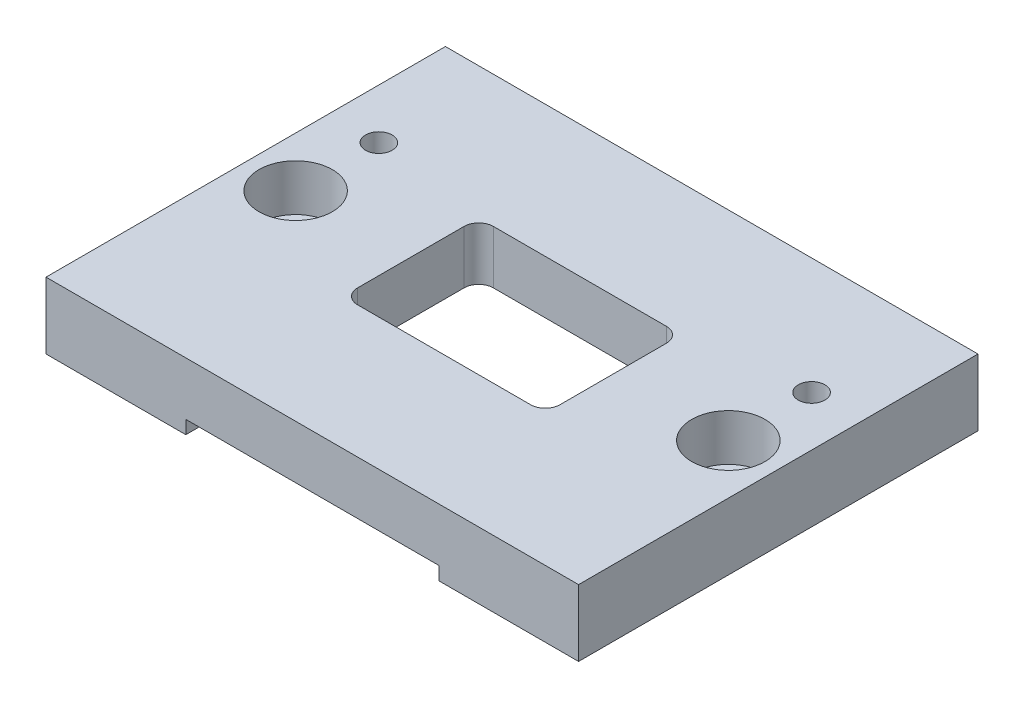
from build123d import *

# Parameters (mm, degrees)
SKETCH1_W           = 80
SKETCH1_H           = 60
BOSS_EXTRUDE3_DEPTH = 10
SKETCH2_R           = 5.5
CUT_EXTRUDE2_DEPTH  = 7
SKETCH3_R           = 2
CUT_EXTRUDE3_DEPTH  = 10
CUT_EXTRUDE4_DEPTH  = 8
SKETCH6_W           = 38
SKETCH6_H           = 2
CUT_EXTRUDE5_DEPTH  = 60
SKETCH7_R           = 3.3
CUT_EXTRUDE7_DEPTH  = 13


with BuildPart() as part:
    # Sketch1 → Boss-Extrude3 (new body)
    with BuildSketch(Plane(origin=(0, 0, 0), x_dir=(1, 0, 0), z_dir=(0, 1, 0))):
        with Locations((-30.040251739, 6.462955974)):
            Rectangle(SKETCH1_W, SKETCH1_H)
    extrude(amount=-BOSS_EXTRUDE3_DEPTH)

    # Sketch2 → Cut-Extrude2 (cut)
    with BuildSketch(Plane(origin=(0, 0, 0), x_dir=(1, 0, 0), z_dir=(0, 1, 0))):
        with Locations(Location((-62.540251739, 6.462955974, 0), (0, 0, 270))):
            Circle(SKETCH2_R)
        with Locations(Location((2.459748261, 6.462955974, 0), (0, 0, 270))):
            Circle(SKETCH2_R)
    extrude(amount=-CUT_EXTRUDE2_DEPTH, mode=Mode.SUBTRACT)

    # Sketch3 → Cut-Extrude3 (cut)
    with BuildSketch(Plane(origin=(0, 0, 0), x_dir=(1, 0, 0), z_dir=(0, 1, 0))):
        with Locations(Location((-62.540251739, 18.962955974, 0), (0, 0, 270))):
            Circle(SKETCH3_R)
        with Locations(Location((2.459748261, 18.962955974, 0), (0, 0, 270))):
            Circle(SKETCH3_R)
    extrude(amount=-CUT_EXTRUDE3_DEPTH, mode=Mode.SUBTRACT)

    # Sketch4 → Cut-Extrude4 (cut)
    with BuildSketch(Plane(origin=(0, 0, 0), x_dir=(1, 0, 0), z_dir=(0, 1, 0))):
        with BuildLine():
            Line((-43.040251739, 16.662955974), (-17.040251739, 16.662955974))
            ThreePointArc((-17.040251739, 16.662955974), (-15.48461682, 16.018590892), (-14.840251739, 14.462955974))
            Line((-14.840251739, 14.462955974), (-14.840251739, -1.537044026))
            ThreePointArc((-14.840251739, -1.537044026), (-15.48461682, -3.092678945), (-17.040251739, -3.737044026))
            Line((-17.040251739, -3.737044026), (-43.040251739, -3.737044026))
            ThreePointArc((-43.040251739, -3.737044026), (-44.595886658, -3.092678945), (-45.240251739, -1.537044026))
            Line((-45.240251739, -1.537044026), (-45.240251739, 14.462955974))
            ThreePointArc((-45.240251739, 14.462955974), (-44.595886658, 16.018590892), (-43.040251739, 16.662955974))
        make_face()
    extrude(amount=-CUT_EXTRUDE4_DEPTH, mode=Mode.SUBTRACT)

    # Sketch6 → Cut-Extrude5 (cut)
    with BuildSketch(Plane.XY.offset(23.537044026)):
        with Locations((-30.040251739, -9)):
            Rectangle(SKETCH6_W, SKETCH6_H)
    extrude(amount=-CUT_EXTRUDE5_DEPTH, mode=Mode.SUBTRACT)

    # Sketch7 → Cut-Extrude7 (cut)
    with BuildSketch(Plane(origin=(0, 0, 0), x_dir=(1, 0, 0), z_dir=(0, 1, 0))):
        with Locations(Location((-62.540251739, 6.462955974, 0), (0, 0, 270))):
            Circle(SKETCH7_R)
        with Locations(Location((2.459748261, 6.462955974, 0), (0, 0, 270))):
            Circle(SKETCH7_R)
    extrude(amount=-CUT_EXTRUDE7_DEPTH, mode=Mode.SUBTRACT)


solid = part.part
